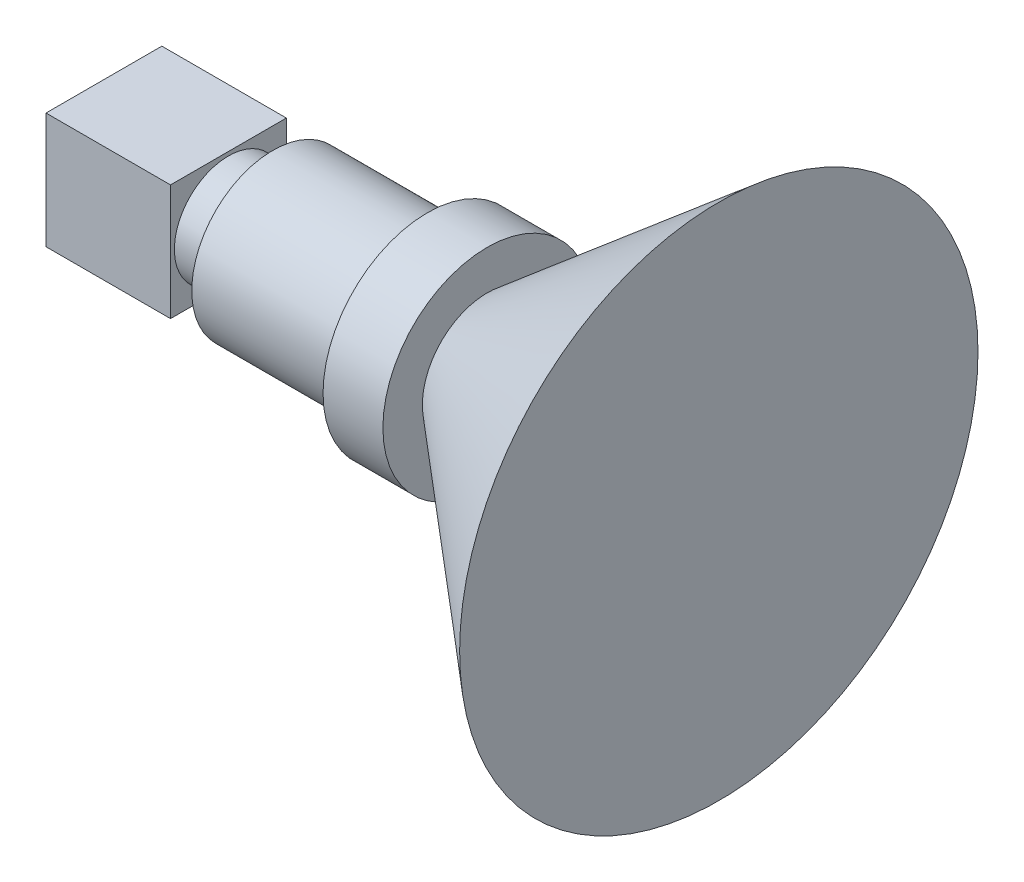
from build123d import *

# Parameters (mm, degrees)
SKETCH2_W                       = 32.25
SKETCH2_H                       = 30
BOSS_EXTRUDE1_DEPTH             = 15
SKETCH4_R                       = 14
BOSS_EXTRUDE2_DEPTH             = 11.5
SKETCH5_R                       = 21
BOSS_EXTRUDE3_DEPTH             = 40
SKETCH6_R                       = 27
BOSS_EXTRUDE4_DEPTH             = 15.5
TAP_DRILL_FOR_1_4_20_TAP1_D     = 5.1054
TAP_DRILL_FOR_1_4_20_TAP1_DEPTH = 4.76
TAP_DRILL_FOR_1_4_20_TAP1_TIP   = 1.533816902


with BuildPart() as part:
    # Sketch2 → Boss-Extrude1 (new, symmetric)
    with BuildSketch(Plane(origin=(0, 0, 0), x_dir=(1, 0, 0), z_dir=(0, 1, 0))):
        Rectangle(SKETCH2_W, SKETCH2_H)
    extrude(amount=BOSS_EXTRUDE1_DEPTH, both=True)

    # Sketch4 → Boss-Extrude2 (add)
    with BuildSketch(Plane(origin=(16.125, 0, 0), x_dir=(0, 0, -1), z_dir=(1, 0, 0))):
        Circle(SKETCH4_R)
    extrude(amount=BOSS_EXTRUDE2_DEPTH)

    # Sketch5 → Boss-Extrude3 (add)
    with BuildSketch(Plane(origin=(27.625, 0, 0), x_dir=(0, 0, -1), z_dir=(1, 0, 0))):
        Circle(SKETCH5_R)
    extrude(amount=BOSS_EXTRUDE3_DEPTH)

    # Sketch6 → Boss-Extrude4 (add)
    with BuildSketch(Plane(origin=(67.625, 0, 0), x_dir=(0, 0, -1), z_dir=(1, 0, 0))):
        Circle(SKETCH6_R)
    extrude(amount=BOSS_EXTRUDE4_DEPTH)

    # Sketch12 → Revolve1 (revolve)
    with BuildSketch(Plane.XY, mode=Mode.PRIVATE) as revolve1_sk:
        Polygon((63.125, 0), (143.125, 67.127970494), (143.125, 0), align=None)
    revolve(revolve1_sk.sketch.rotate(Axis((63.125, 0, 0), (1, 0, 0)), 270), axis=Axis((63.125, 0, 0), (1, 0, 0)))

    # Tap Drill for 1/4-20 Tap1
    with Locations(Plane(origin=(0, -15, 0), x_dir=(-1, 0, 0), z_dir=(0, -1, 0))):
        with Locations((12.125, 0)):
            Hole(TAP_DRILL_FOR_1_4_20_TAP1_D / 2, depth=TAP_DRILL_FOR_1_4_20_TAP1_DEPTH)
            with Locations((0, 0, -(TAP_DRILL_FOR_1_4_20_TAP1_DEPTH + TAP_DRILL_FOR_1_4_20_TAP1_TIP / 2))):  # 118° drill point
                Cone(0, TAP_DRILL_FOR_1_4_20_TAP1_D / 2, TAP_DRILL_FOR_1_4_20_TAP1_TIP, mode=Mode.SUBTRACT)


solid = part.part
